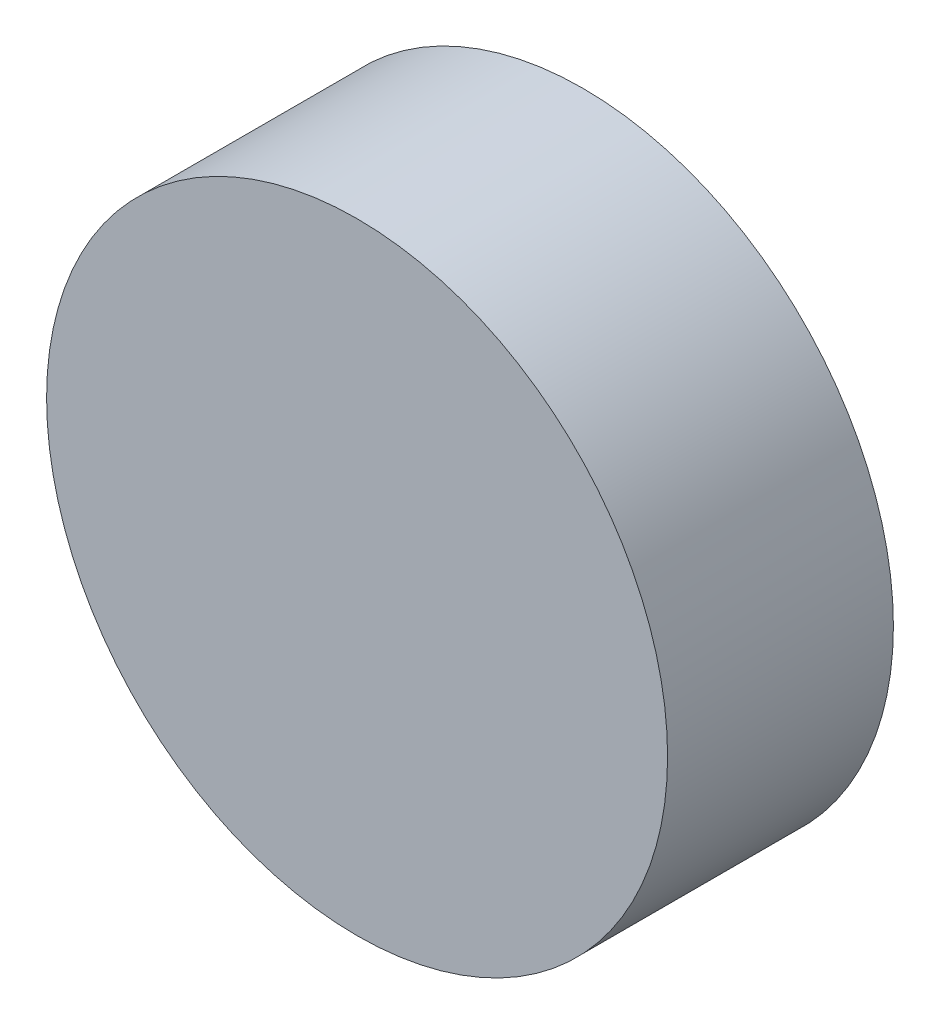
from build123d import *

# Parameters (mm, degrees)
SKETCH_1_R          = 55
EXTRUDE_1_DEPTH     = 40
SKETCH_3_R          = 25
CUT_EXTRUDE_1_DEPTH = 20


with BuildPart() as part:
    # 草圖1 → 填料-伸長1 (new body)
    with BuildSketch(Plane.XY):
        Circle(SKETCH_1_R)
    extrude(amount=EXTRUDE_1_DEPTH)

    # 草圖3 → 除料-伸長1 (cut)
    with BuildSketch(Plane(origin=(0, 0, 0), x_dir=(-1, 0, 0), z_dir=(0, 0, -1))):
        Circle(SKETCH_3_R)
    extrude(amount=-CUT_EXTRUDE_1_DEPTH, mode=Mode.SUBTRACT)


solid = part.part
